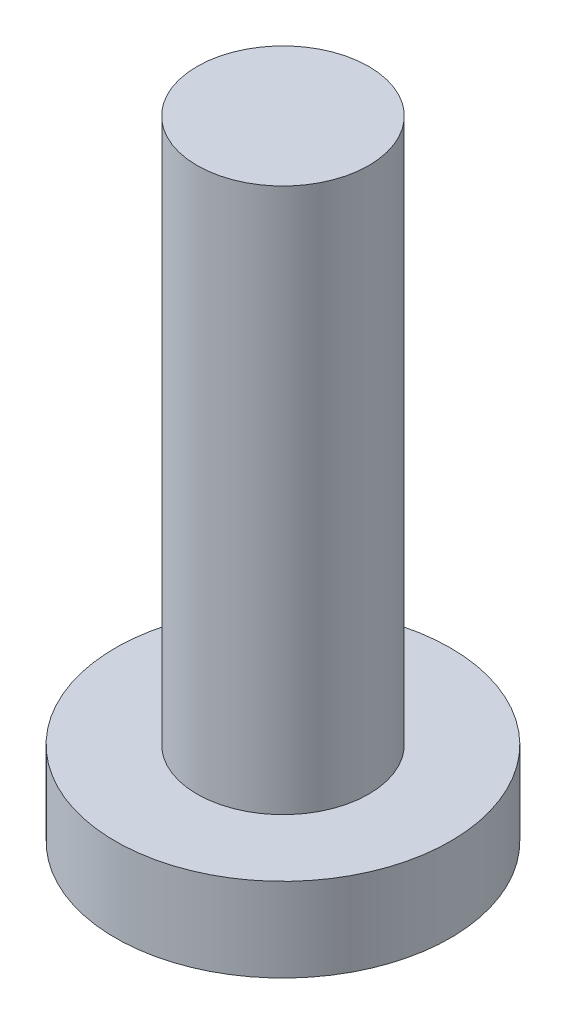
from build123d import *

# Parameters (mm, degrees)
SKETCH2_R           = 1.025
BOSS_EXTRUDE1_DEPTH = 6.5
SKETCH3_R           = 2
BOSS_EXTRUDE2_DEPTH = 1


with BuildPart() as part:
    # Sketch2 → Boss-Extrude1 (new body)
    with BuildSketch(Plane(origin=(0, 0, 0), x_dir=(1, 0, 0), z_dir=(0, 1, 0))):
        with Locations(Location((0, 0, 0), (0, 0, 90))):
            Circle(SKETCH2_R)
    extrude(amount=BOSS_EXTRUDE1_DEPTH)

    # Sketch3 → Boss-Extrude2 (add)
    with BuildSketch(Plane.XZ):
        with Locations(Location((0, 0, 0), (0, 0, 270))):
            Circle(SKETCH3_R)
    extrude(amount=BOSS_EXTRUDE2_DEPTH)


solid = part.part
